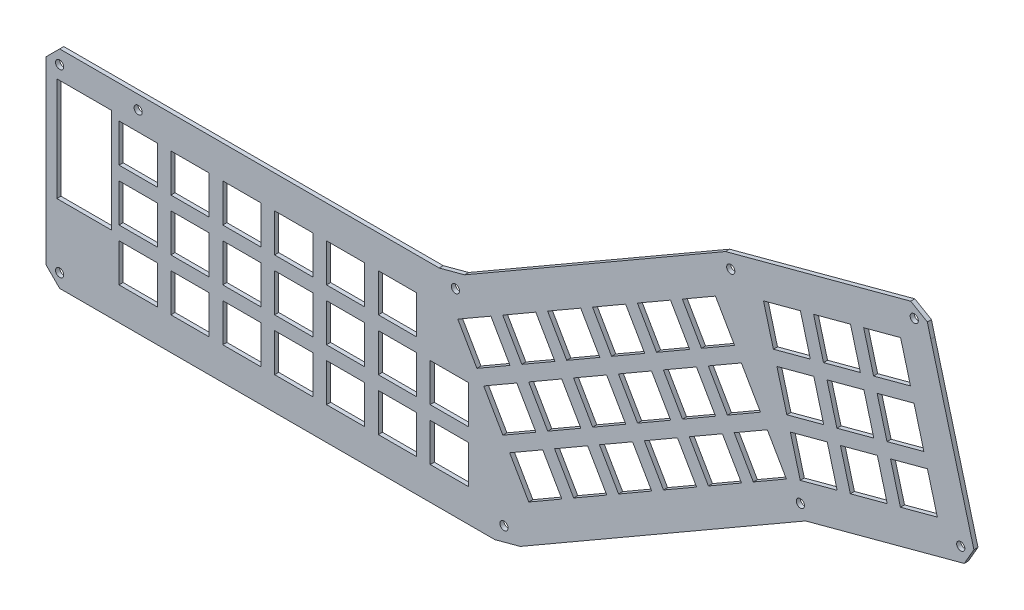
from build123d import *

# Parameters (mm, degrees)
ESQUISSE1_R        = 1.5
ESQUISSE1_W        = 14
ESQUISSE1_H        = 14
ESQUISSE1_W_2      = 20
ESQUISSE1_H_2      = 38
BOSS_EXTRU_1_DEPTH = 1.5


with BuildPart() as part:
    # Esquisse1 → Boss.-Extru.1 (new body)
    with BuildSketch(Plane.XY):
        Polygon((223.435307281, 116.571144171), (228.094050093, 99.184479298), (239.223269033, 57.649668767), (235.687735127, 51.52594441), (177.550794817, 35.948198204), (72.998852881, -24.414893617), (63.668725862, -26.914893617), (-95.753762562, -26.914893617), (-100.753762562, -21.914893617), (-100.753762562, 35.79522772), (-100.753762562, 44.085106383), (-95.753762562, 49.085106383), (-75.988646329, 49.085106383), (43.304587238, 49.085106383), (52.634714257, 51.585106383), (148.215889778, 106.7689238), (211.187858568, 123.642211983), (216.073234813, 124.951244602), (222.169064525, 121.408322556), align=None)
        with Locations((-95.753762562, 44.085106383)):
            Circle(ESQUISSE1_R, mode=Mode.SUBTRACT)
        with Locations((-95.753762562, -21.914893617)):
            Circle(ESQUISSE1_R, mode=Mode.SUBTRACT)
        with Locations((67.039694146, -20.835264486)):
            Circle(ESQUISSE1_R, mode=Mode.SUBTRACT)
        with Locations((49.263745973, 45.505477252)):
            Circle(ESQUISSE1_R, mode=Mode.SUBTRACT)
        with Locations((175.637377655, 40.567595866)):
            Circle(ESQUISSE1_R, mode=Mode.SUBTRACT)
        with Locations((150.12930694, 102.149526137)):
            Circle(ESQUISSE1_R, mode=Mode.SUBTRACT)
        with Locations((234.393639901, 56.355573542)):
            Circle(ESQUISSE1_R, mode=Mode.SUBTRACT)
        with Locations((217.363403759, 120.120565138)):
            Circle(ESQUISSE1_R, mode=Mode.SUBTRACT)
        with Locations((-66.988646329, 44.085106383)):
            Circle(ESQUISSE1_R, mode=Mode.SUBTRACT)
        with Locations((-66.988646329, 11.085106383)):
            Rectangle(ESQUISSE1_W, ESQUISSE1_H, mode=Mode.SUBTRACT)
        with Locations((-66.988646329, 30.085106383)):
            Rectangle(ESQUISSE1_W, ESQUISSE1_H, mode=Mode.SUBTRACT)
        with Locations((-66.988646329, -7.914893617)):
            Rectangle(ESQUISSE1_W, ESQUISSE1_H, mode=Mode.SUBTRACT)
        with Locations((-47.988646329, 11.085106383)):
            Rectangle(ESQUISSE1_W, ESQUISSE1_H, mode=Mode.SUBTRACT)
        with Locations((-47.988646329, 30.085106383)):
            Rectangle(ESQUISSE1_W, ESQUISSE1_H, mode=Mode.SUBTRACT)
        with Locations((-47.988646329, -7.914893617)):
            Rectangle(ESQUISSE1_W, ESQUISSE1_H, mode=Mode.SUBTRACT)
        with Locations((-28.988646329, 11.085106383)):
            Rectangle(ESQUISSE1_W, ESQUISSE1_H, mode=Mode.SUBTRACT)
        with Locations((-28.988646329, 30.085106383)):
            Rectangle(ESQUISSE1_W, ESQUISSE1_H, mode=Mode.SUBTRACT)
        with Locations((-28.988646329, -7.914893617)):
            Rectangle(ESQUISSE1_W, ESQUISSE1_H, mode=Mode.SUBTRACT)
        with Locations((-9.988646329, 11.085106383)):
            Rectangle(ESQUISSE1_W, ESQUISSE1_H, mode=Mode.SUBTRACT)
        with Locations((-9.988646329, 30.085106383)):
            Rectangle(ESQUISSE1_W, ESQUISSE1_H, mode=Mode.SUBTRACT)
        with Locations((-9.988646329, -7.914893617)):
            Rectangle(ESQUISSE1_W, ESQUISSE1_H, mode=Mode.SUBTRACT)
        with Locations((9.011353671, 11.085106383)):
            Rectangle(ESQUISSE1_W, ESQUISSE1_H, mode=Mode.SUBTRACT)
        with Locations((9.011353671, 30.085106383)):
            Rectangle(ESQUISSE1_W, ESQUISSE1_H, mode=Mode.SUBTRACT)
        with Locations((9.011353671, -7.914893617)):
            Rectangle(ESQUISSE1_W, ESQUISSE1_H, mode=Mode.SUBTRACT)
        with Locations((28.011353671, 11.085106383)):
            Rectangle(ESQUISSE1_W, ESQUISSE1_H, mode=Mode.SUBTRACT)
        with Locations((28.011353671, 30.085106383)):
            Rectangle(ESQUISSE1_W, ESQUISSE1_H, mode=Mode.SUBTRACT)
        with Locations((28.011353671, -7.914893617)):
            Rectangle(ESQUISSE1_W, ESQUISSE1_H, mode=Mode.SUBTRACT)
        with Locations((47.011353671, 11.085106383)):
            Rectangle(ESQUISSE1_W, ESQUISSE1_H, mode=Mode.SUBTRACT)
        with Locations((47.011353671, -7.914893617)):
            Rectangle(ESQUISSE1_W, ESQUISSE1_H, mode=Mode.SUBTRACT)
        Polygon((69.12536992, 3.37096395), (76.12536992, -8.753391703), (88.249725572, -1.753391703), (81.249725572, 10.37096395), align=None, mode=Mode.SUBTRACT)
        Polygon((59.62536992, 19.825446622), (66.62536992, 7.701090969), (78.749725572, 14.701090969), (71.749725572, 26.825446622), align=None, mode=Mode.SUBTRACT)
        Polygon((50.12536992, 36.279929294), (57.12536992, 24.155573641), (69.249725572, 31.155573641), (62.249725572, 43.279929294), align=None, mode=Mode.SUBTRACT)
        Polygon((85.579852591, 12.87096395), (92.579852591, 0.746608297), (104.704208244, 7.746608297), (97.704208244, 19.87096395), align=None, mode=Mode.SUBTRACT)
        Polygon((76.079852591, 29.325446622), (83.079852591, 17.201090969), (95.204208244, 24.201090969), (88.204208244, 36.325446622), align=None, mode=Mode.SUBTRACT)
        Polygon((66.579852591, 45.779929294), (73.579852591, 33.655573641), (85.704208244, 40.655573641), (78.704208244, 52.779929294), align=None, mode=Mode.SUBTRACT)
        Polygon((102.034335263, 22.37096395), (109.034335263, 10.246608297), (121.158690916, 17.246608297), (114.158690916, 29.37096395), align=None, mode=Mode.SUBTRACT)
        Polygon((92.534335263, 38.825446622), (99.534335263, 26.701090969), (111.658690916, 33.701090969), (104.658690916, 45.825446622), align=None, mode=Mode.SUBTRACT)
        Polygon((83.034335263, 55.279929294), (90.034335263, 43.155573641), (102.158690916, 50.155573641), (95.158690916, 62.279929294), align=None, mode=Mode.SUBTRACT)
        Polygon((118.488817935, 31.87096395), (125.488817935, 19.746608297), (137.613173588, 26.746608297), (130.613173588, 38.87096395), align=None, mode=Mode.SUBTRACT)
        Polygon((108.988817935, 48.325446622), (115.988817935, 36.201090969), (128.113173588, 43.201090969), (121.113173588, 55.325446622), align=None, mode=Mode.SUBTRACT)
        Polygon((99.488817935, 64.779929294), (106.488817935, 52.655573641), (118.613173588, 59.655573641), (111.613173588, 71.779929294), align=None, mode=Mode.SUBTRACT)
        Polygon((134.943300607, 41.37096395), (141.943300607, 29.246608297), (154.06765626, 36.246608297), (147.06765626, 48.37096395), align=None, mode=Mode.SUBTRACT)
        Polygon((125.443300607, 57.825446622), (132.443300607, 45.701090969), (144.56765626, 52.701090969), (137.56765626, 64.825446622), align=None, mode=Mode.SUBTRACT)
        Polygon((115.943300607, 74.279929294), (122.943300607, 62.155573641), (135.06765626, 69.155573641), (128.06765626, 81.279929294), align=None, mode=Mode.SUBTRACT)
        Polygon((151.397783279, 50.87096395), (158.397783279, 38.746608297), (170.522138932, 45.746608297), (163.522138932, 57.87096395), align=None, mode=Mode.SUBTRACT)
        Polygon((141.897783279, 67.325446622), (148.897783279, 55.201090969), (161.022138932, 62.201090969), (154.022138932, 74.325446622), align=None, mode=Mode.SUBTRACT)
        Polygon((132.397783279, 83.779929294), (139.397783279, 71.655573641), (151.522138932, 78.655573641), (144.522138932, 90.779929294), align=None, mode=Mode.SUBTRACT)
        Polygon((167.051254346, 79.722282932), (180.574215914, 83.345749564), (184.197682546, 69.822787996), (170.674720978, 66.199321364), align=None, mode=Mode.SUBTRACT)
        Polygon((162.133692489, 98.074873632), (175.656654057, 101.698340263), (179.280120689, 88.175378695), (165.757159121, 84.551912064), align=None, mode=Mode.SUBTRACT)
        Polygon((171.968816203, 61.369692233), (185.491777771, 64.993158864), (189.115244403, 51.470197296), (175.592282834, 47.846730665), align=None, mode=Mode.SUBTRACT)
        Polygon((185.403845046, 84.639844789), (198.926806614, 88.263311421), (202.550273245, 74.740349853), (189.027311677, 71.116883221), align=None, mode=Mode.SUBTRACT)
        Polygon((180.486283189, 102.992435489), (194.009244757, 106.61590212), (197.632711388, 93.092940552), (184.10974982, 89.469473921), align=None, mode=Mode.SUBTRACT)
        Polygon((190.321406903, 66.28725409), (203.844368471, 69.910720721), (207.467835102, 56.387759153), (193.944873534, 52.764292522), align=None, mode=Mode.SUBTRACT)
        Polygon((203.756435745, 89.557406646), (217.279397313, 93.180873278), (220.902863945, 79.65791171), (207.379902377, 76.034445078), align=None, mode=Mode.SUBTRACT)
        Polygon((198.838873888, 107.909997346), (212.361835456, 111.533463977), (215.985302088, 98.010502409), (202.46234052, 94.387035778), align=None, mode=Mode.SUBTRACT)
        Polygon((208.673997602, 71.204815947), (222.19695917, 74.828282578), (225.820425801, 61.30532101), (212.297464233, 57.681854379), align=None, mode=Mode.SUBTRACT)
        with Locations((-86.753762562, 20.085106383)):
            Rectangle(ESQUISSE1_W_2, ESQUISSE1_H_2, mode=Mode.SUBTRACT)
    extrude(amount=BOSS_EXTRU_1_DEPTH)


solid = part.part
